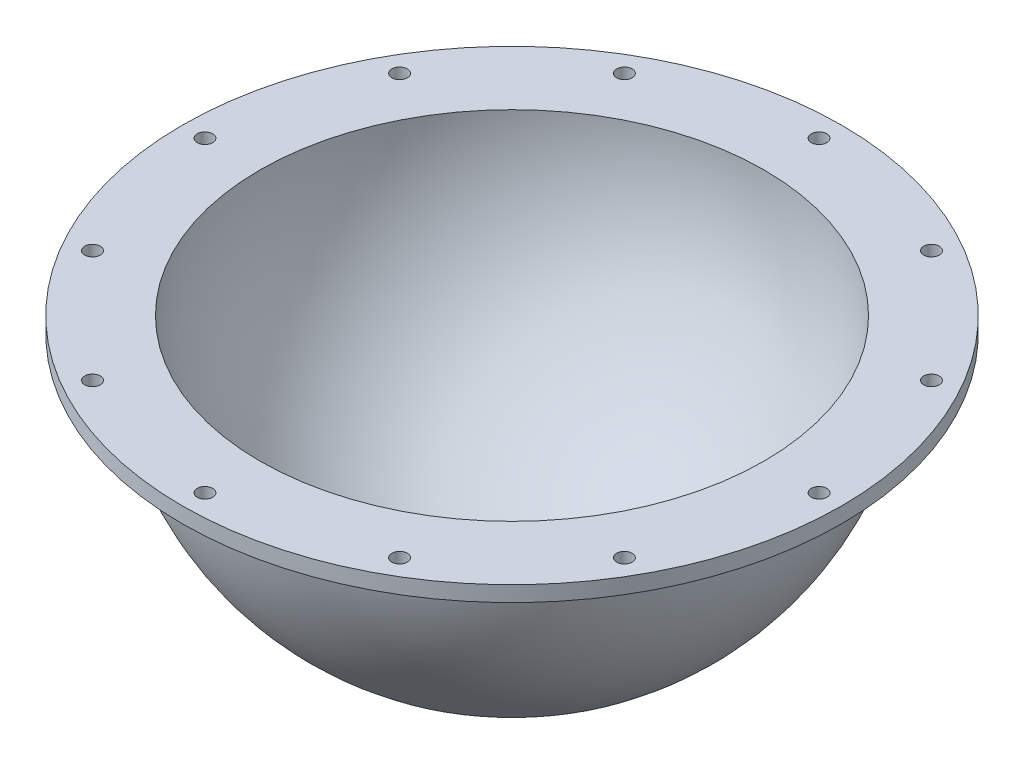
from build123d import *

# Parameters (mm, degrees)
REVOLVE1_ANGLE     = 180
SKETCH10_R         = 6
CUT_EXTRUDE1_DEPTH = 423.433426708


with BuildPart() as part:
    # Sketch1 → Revolve1 (revolve)
    with BuildSketch(Plane(origin=(0, 0, 0), x_dir=(1, 0, 0), z_dir=(0, 1, 0))):
        with BuildLine():
            Line((0, 220), (0, 195))
            ThreePointArc((0, 195), (-195, 0), (0, -195))
            Line((0, -195), (0, -220))
            ThreePointArc((0, -220), (-220, 0), (0, 220))
        make_face()
    revolve(axis=Axis((0, 0, -220), (0, 0, 1)), revolution_arc=REVOLVE1_ANGLE)

    # Sketch3 → Revolve2 (revolve)
    with BuildSketch(Plane(origin=(0, 0, 0), x_dir=(0, 0, -1), z_dir=(1, 0, 0)), mode=Mode.PRIVATE) as revolve2_sk:
        with BuildLine():
            Line((-220, 0), (-255, 0))
            Line((-255, 0), (-255, -12))
            Line((-255, -12), (-219.672483484, -12))
            ThreePointArc((-219.672483484, -12), (-219.918105629, -6.002234315), (-220, 0))
        make_face()
    revolve(revolve2_sk.sketch.rotate(Axis((0, 0, 0), (0, 1, 0)), 180), axis=Axis((0, 0, 0), (0, 1, 0)))

    # Sketch10 → Cut-Extrude1 (cut, through all)
    with BuildSketch(Plane(origin=(0, 0, 0), x_dir=(1, 0, 0), z_dir=(0, 1, 0))):
        with Locations(Location((0, 237.5, 0), (0, 0, 180))):
            Circle(SKETCH10_R)
        with Locations(Location((-118.75, 205.681033399, 0), (0, 0, 180))):
            Circle(SKETCH10_R)
        with Locations(Location((-205.681033399, 118.75, 0), (0, 0, 180))):
            Circle(SKETCH10_R)
        with Locations(Location((-237.5, 0, 0), (0, 0, 180))):
            Circle(SKETCH10_R)
        with Locations(Location((-205.681033399, -118.75, 0), (0, 0, 180))):
            Circle(SKETCH10_R)
        with Locations(Location((-118.75, -205.681033399, 0), (0, 0, 180))):
            Circle(SKETCH10_R)
        with Locations(Location((0, -237.5, 0), (0, 0, 180))):
            Circle(SKETCH10_R)
        with Locations(Location((118.75, -205.681033399, 0), (0, 0, 180))):
            Circle(SKETCH10_R)
        with Locations(Location((205.681033399, -118.75, 0), (0, 0, 180))):
            Circle(SKETCH10_R)
        with Locations(Location((237.5, 0, 0), (0, 0, 180))):
            Circle(SKETCH10_R)
        with Locations(Location((205.681033399, 118.75, 0), (0, 0, 180))):
            Circle(SKETCH10_R)
        with Locations(Location((118.75, 205.681033399, 0), (0, 0, 180))):
            Circle(SKETCH10_R)
    extrude(amount=-CUT_EXTRUDE1_DEPTH, mode=Mode.SUBTRACT)


solid = part.part
